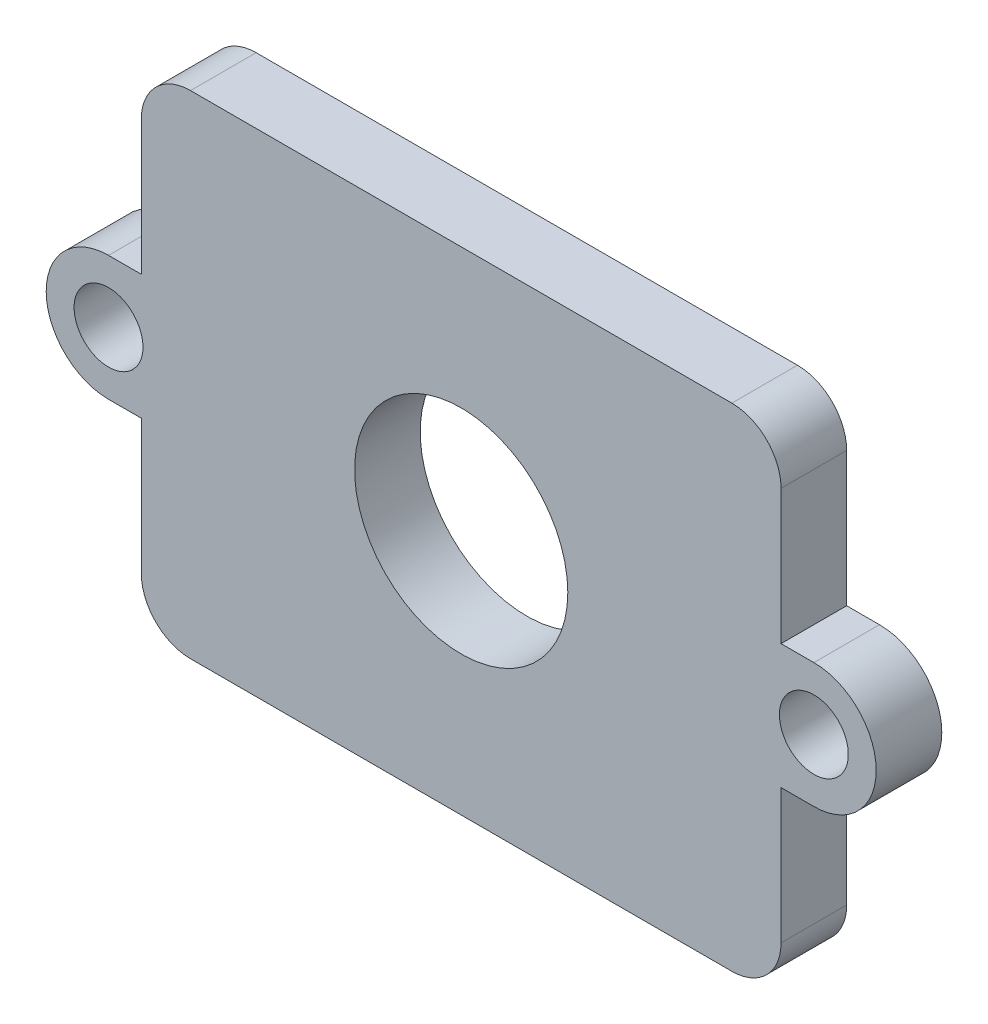
from build123d import *

# Parameters (mm, degrees)
SKETCH1_R           = 6.5
BOSS_EXTRUDE1_DEPTH = 4
BOSS_EXTRUDE2_DEPTH = 4
SKETCH3_R           = 2.1
CUT_EXTRUDE1_DEPTH  = 30.683160209
FILLET1_R           = 3


with BuildPart() as part:
    # Sketch1 → Boss-Extrude1 (new body)
    with BuildSketch(Plane.XY):
        Polygon((19.5, 3.8), (21.5, 3.8), (21.5, -3.8), (19.5, -3.8), (19.5, -15), (-19.5, -15), (-19.5, -3.8), (-21.5, -3.8), (-21.5, 3.8), (-19.5, 3.8), (-19.5, 15), (19.5, 15), align=None)
        Circle(SKETCH1_R, mode=Mode.SUBTRACT)
    extrude(amount=BOSS_EXTRUDE1_DEPTH)

    # Sketch2 → Boss-Extrude2 (add)
    with BuildSketch(Plane.XY.offset(4)):
        with BuildLine():
            Line((-21.5, 3.8), (-21.5, -3.8))
            ThreePointArc((-21.5, -3.8), (-25.3, 0), (-21.5, 3.8))
        make_face()
    boss_extrude2 = extrude(amount=-BOSS_EXTRUDE2_DEPTH)

    # Sketch3 → Cut-Extrude1 (cut, through all)
    with BuildSketch(Plane.XY.offset(4)):
        with Locations((-21.5, 0)):
            Circle(SKETCH3_R)
    cut_extrude1 = extrude(amount=-CUT_EXTRUDE1_DEPTH, mode=Mode.SUBTRACT)

    # Mirror1: Boss-Extrude2, Cut-Extrude1 across plane
    add(boss_extrude2.mirror(Plane.ZY))
    add(cut_extrude1.mirror(Plane.ZY), mode=Mode.SUBTRACT)

    # Fillet1
    fillet1_edges = [part.edges().sort_by_distance(p)[0] for p in [
        (19.5, -15, 2),
        (-19.5, -15, 2),
        (-19.5, 15, 2),
        (19.5, 15, 2),
    ]]
    fillet(fillet1_edges, radius=FILLET1_R)


solid = part.part
